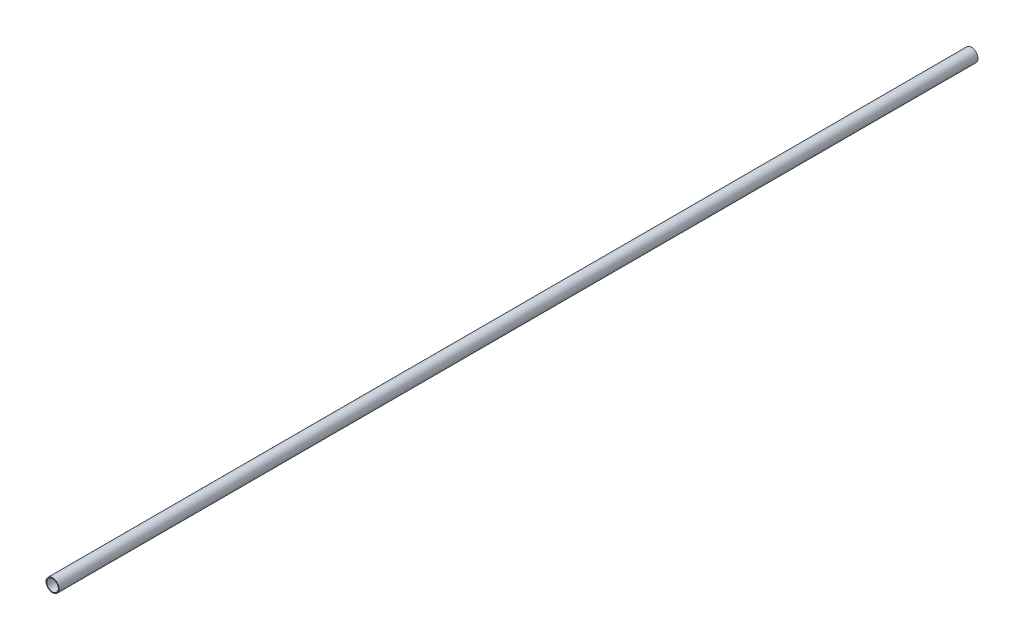
from build123d import *

# Parameters (mm, degrees)
SKETCH1_R           = 6.5
SKETCH1_R_2         = 5.75
BOSS_EXTRUDE1_DEPTH = 457.2


with BuildPart() as part:
    # Sketch1 → Boss-Extrude1 (new, symmetric)
    with BuildSketch(Plane.XY):
        Circle(SKETCH1_R)
        Circle(SKETCH1_R_2, mode=Mode.SUBTRACT)
    extrude(amount=BOSS_EXTRUDE1_DEPTH, both=True)


solid = part.part
